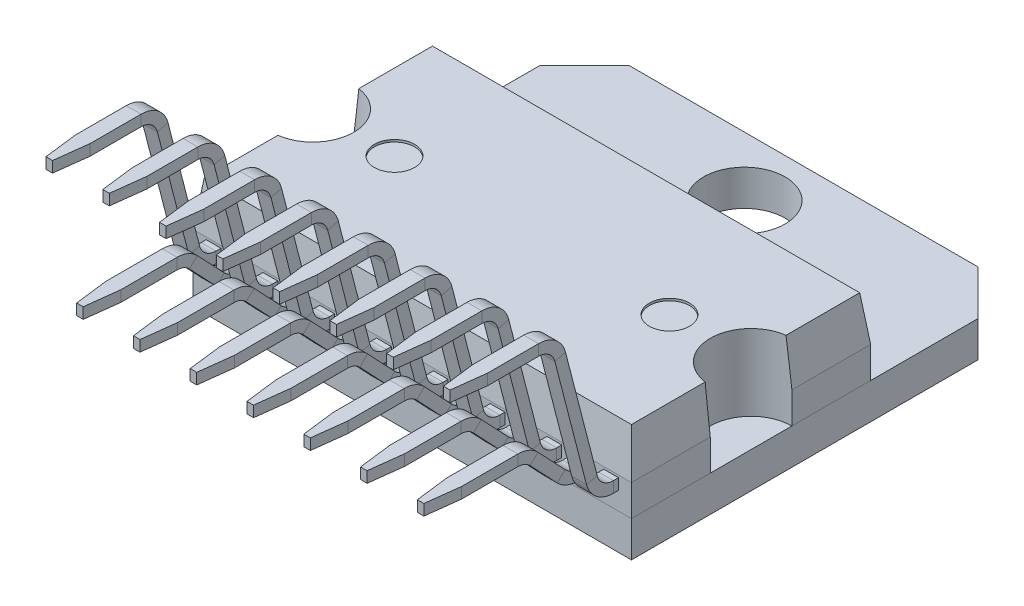
from build123d import *
from OCP.BRepFilletAPI import BRepFilletAPI_MakeChamfer

# Parameters (mm, degrees)
SKETCH_1_R                              = 1.825
EXTRUDE_1_DEPTH                         = 1.6
SKETCH_2_W                              = 19.6
SKETCH_2_H                              = 10.7
EXTRUDE_2_DEPTH                         = 3.4
CHAMFER_1_SIZE                          = 2
CHAMFER_1_SIZE2                         = 0.245569122
SKETCH_3_R                              = 1.825
CUT_EXTRUDE_1_DEPTH                     = 3.4
SKETCH_4_R                              = 0.9
CUT_EXTRUDE_2_DEPTH                     = 0.1
SKETCH_6_W                              = 0.66
SKETCH_6_H                              = 0.49
CHAMFER_2_SIZE                          = 1.5
CHAMFER_2_SIZE2                         = 0.184176841
PATTERN_LINEAR_4_COUNT                  = 4
PATTERN_LINEAR_4_PITCH                  = 2.54
CHAMFER_2_OF_PATTERN_LINEAR_4_SIZE      = 1.5
CHAMFER_2_OF_PATTERN_LINEAR_4_SIZE2     = 0.184176841
PATTERN_LINEAR_4_COL_COUNT              = 4
PATTERN_LINEAR_4_COL_PITCH              = 2.54
CHAMFER_2_OF_PATTERN_LINEAR_4_COL_SIZE  = 1.5
CHAMFER_2_OF_PATTERN_LINEAR_4_COL_SIZE2 = 0.184176841
SKETCH_8_W                              = 0.66
SKETCH_8_H                              = 0.49
CHAMFER_3_SIZE                          = 1.5
CHAMFER_3_SIZE2                         = 0.184176841
PATTERN_LINEAR_5_COUNT                  = 8
PATTERN_LINEAR_5_PITCH                  = 2.54
CHAMFER_3_OF_PATTERN_LINEAR_5_SIZE      = 1.5
CHAMFER_3_OF_PATTERN_LINEAR_5_SIZE2     = 0.184176841


with BuildPart() as part:
    # 草图1 → 凸台-拉伸1 (new body)
    with BuildSketch(Plane(origin=(0, 0, 0), x_dir=(1, 0, 0), z_dir=(0, 1, 0))):
        Polygon((0, 0), (-9.8, 0), (-9.8, 15.5), (-7.8, 17.5), (7.8, 17.5), (9.8, 15.5), (9.8, 0), align=None)
        with Locations(Location((0, 14.85, 0), (0, 0, 270))):
            Circle(SKETCH_1_R, mode=Mode.SUBTRACT)
    extrude(amount=EXTRUDE_1_DEPTH)


with BuildPart() as body_2:
    # 草图2 → 凸台-拉伸2 (new body)
    with BuildSketch(Plane(origin=(0, 1.6, 0), x_dir=(1, 0, 0), z_dir=(0, 1, 0))):
        with Locations((0, 5.35)):
            Rectangle(SKETCH_2_W, SKETCH_2_H)
    extrude(amount=EXTRUDE_2_DEPTH)

    # 倒角1: one chamfer whose edges measure the first distance from different faces: ONE call of the kernel's chamfer builder (chamfer() names one face for all edges)
    chamfer_1_edges_1 = [body_2.edges().sort_by_distance(p)[0] for p in [
        (9.8, 5, -5.35),
    ]]
    chamfer_1_side_1 = [body_2.faces().sort_by_distance(p)[0] for p in [
        (9.8, 3.3, -5.35),
    ]]
    chamfer_1_edges_2 = [body_2.edges().sort_by_distance(p)[0] for p in [
        (0, 5, -10.7),
    ]]
    chamfer_1_side_2 = [body_2.faces().sort_by_distance(p)[0] for p in [
        (0, 3.3, -10.7),
    ]]
    chamfer_1_edges_3 = [body_2.edges().sort_by_distance(p)[0] for p in [
        (-9.8, 5, -5.35),
    ]]
    chamfer_1_side_3 = [body_2.faces().sort_by_distance(p)[0] for p in [
        (-9.8, 3.3, -5.35),
    ]]
    chamfer_1_edges_4 = [body_2.edges().sort_by_distance(p)[0] for p in [
        (0, 5, 0),
    ]]
    chamfer_1_side_4 = [body_2.faces().sort_by_distance(p)[0] for p in [
        (0, 3.3, 0),
    ]]
    chamfer_1 = BRepFilletAPI_MakeChamfer(body_2.part.solid().wrapped)
    for e in chamfer_1_edges_1:
        chamfer_1.Add(CHAMFER_1_SIZE, CHAMFER_1_SIZE2, e.wrapped, chamfer_1_side_1[0].wrapped)  # the first distance lies on this face
    for e in chamfer_1_edges_2:
        chamfer_1.Add(CHAMFER_1_SIZE, CHAMFER_1_SIZE2, e.wrapped, chamfer_1_side_2[0].wrapped)  # the first distance lies on this face
    for e in chamfer_1_edges_3:
        chamfer_1.Add(CHAMFER_1_SIZE, CHAMFER_1_SIZE2, e.wrapped, chamfer_1_side_3[0].wrapped)  # the first distance lies on this face
    for e in chamfer_1_edges_4:
        chamfer_1.Add(CHAMFER_1_SIZE, CHAMFER_1_SIZE2, e.wrapped, chamfer_1_side_4[0].wrapped)  # the first distance lies on this face
    add(Compound.cast(chamfer_1.Shape()), mode=Mode.REPLACE)

    # 草图3 → 切除-拉伸1 (cut)
    with BuildSketch(Plane(origin=(0, 5, 0), x_dir=(1, 0, 0), z_dir=(0, 1, 0))):
        with Locations((-9.8, 5.35)):
            Circle(SKETCH_3_R)
        with Locations((9.8, 5.35)):
            Circle(SKETCH_3_R)
    extrude(amount=-CUT_EXTRUDE_1_DEPTH, mode=Mode.SUBTRACT)

    # 草图4 → 切除-拉伸2 (cut)
    with BuildSketch(Plane(origin=(0, 5, 0), x_dir=(1, 0, 0), z_dir=(0, 1, 0))):
        with Locations(Location((-6.15, 5.35, 0), (0, 0, 270))):
            Circle(SKETCH_4_R)
        with Locations(Location((6.15, 5.35, 0), (0, 0, 90))):
            Circle(SKETCH_4_R)
    extrude(amount=-CUT_EXTRUDE_2_DEPTH, mode=Mode.SUBTRACT)

    # 扫描2: sweep along a path in 草图5
    with BuildLine(Plane(origin=(0, 0, 0), x_dir=(0, 0, -1), z_dir=(1, 0, 0))) as sweep_2_path:
        Line((0, 2.65), (-0.569868176, 2.65))
        ThreePointArc((-0.569868176, 2.65), (-0.964998124, 2.731374764), (-1.29582086, 2.962255352))
        Line((-1.29582086, 2.962255352), (-2.50417914, 4.237744648))
        ThreePointArc((-2.50417914, 4.237744648), (-2.835001876, 4.468625236), (-3.230131824, 4.55))
        Line((-3.230131824, 4.55), (-7.25, 4.55))
    # 草图6 → 扫描2 (sweep)
    with BuildSketch(Plane.XY):
        with Locations((0, 2.65)):
            Rectangle(SKETCH_6_W, SKETCH_6_H)
    sweep_2 = sweep(path=sweep_2_path.line)

    # 倒角2: one chamfer whose edges measure the first distance from different faces: ONE call of the kernel's chamfer builder (chamfer() names one face for all edges)
    chamfer_2_edges_1 = [body_2.edges().sort_by_distance(p)[0] for p in [
        (0.33, 4.55, 7.25),
    ]]
    chamfer_2_side_1 = [body_2.faces().sort_by_distance(p)[0] for p in [
        (0.33, 2.481337802, 0.284934088),
    ]]
    chamfer_2_edges_2 = [body_2.edges().sort_by_distance(p)[0] for p in [
        (-0.33, 4.55, 7.25),
    ]]
    chamfer_2_side_2 = [body_2.faces().sort_by_distance(p)[0] for p in [
        (-0.33, 2.818662198, 0.284934088),
    ]]
    chamfer_2 = BRepFilletAPI_MakeChamfer(body_2.part.solid().wrapped)
    for e in chamfer_2_edges_1:
        chamfer_2.Add(CHAMFER_2_SIZE, CHAMFER_2_SIZE2, e.wrapped, chamfer_2_side_1[0].wrapped)  # the first distance lies on this face
    for e in chamfer_2_edges_2:
        chamfer_2.Add(CHAMFER_2_SIZE, CHAMFER_2_SIZE2, e.wrapped, chamfer_2_side_2[0].wrapped)  # the first distance lies on this face
    add(Compound.cast(chamfer_2.Shape()), mode=Mode.REPLACE)

    # 阵列(线性)4: 扫描2 ×4
    with Locations(*[(i * PATTERN_LINEAR_4_PITCH, 0, 0) for i in range(1, PATTERN_LINEAR_4_COUNT)]):
        add(sweep_2)

    # 倒角2 of 阵列(线性)4: one chamfer whose edges measure the first distance from different faces: ONE call of the kernel's chamfer builder (chamfer() names one face for all edges)
    chamfer_2_of_pattern_linear_4_edges_1 = [body_2.edges().sort_by_distance(p)[0] for p in [
        (2.87, 4.55, 7.25),
    ]]
    chamfer_2_of_pattern_linear_4_side_1 = [body_2.faces().sort_by_distance(p)[0] for p in [
        (2.87, 2.481337802, 0.284934088),
    ]]
    chamfer_2_of_pattern_linear_4_edges_2 = [body_2.edges().sort_by_distance(p)[0] for p in [
        (2.21, 4.55, 7.25),
    ]]
    chamfer_2_of_pattern_linear_4_side_2 = [body_2.faces().sort_by_distance(p)[0] for p in [
        (2.21, 2.818662198, 0.284934088),
    ]]
    chamfer_2_of_pattern_linear_4_edges_3 = [body_2.edges().sort_by_distance(p)[0] for p in [
        (5.41, 4.55, 7.25),
    ]]
    chamfer_2_of_pattern_linear_4_side_3 = [body_2.faces().sort_by_distance(p)[0] for p in [
        (5.41, 2.481337802, 0.284934088),
    ]]
    chamfer_2_of_pattern_linear_4_edges_4 = [body_2.edges().sort_by_distance(p)[0] for p in [
        (4.75, 4.55, 7.25),
    ]]
    chamfer_2_of_pattern_linear_4_side_4 = [body_2.faces().sort_by_distance(p)[0] for p in [
        (4.75, 2.818662198, 0.284934088),
    ]]
    chamfer_2_of_pattern_linear_4_edges_5 = [body_2.edges().sort_by_distance(p)[0] for p in [
        (7.95, 4.55, 7.25),
    ]]
    chamfer_2_of_pattern_linear_4_side_5 = [body_2.faces().sort_by_distance(p)[0] for p in [
        (7.95, 2.481337802, 0.284934088),
    ]]
    chamfer_2_of_pattern_linear_4_edges_6 = [body_2.edges().sort_by_distance(p)[0] for p in [
        (7.29, 4.55, 7.25),
    ]]
    chamfer_2_of_pattern_linear_4_side_6 = [body_2.faces().sort_by_distance(p)[0] for p in [
        (7.29, 2.818662198, 0.284934088),
    ]]
    chamfer_2_of_pattern_linear_4 = BRepFilletAPI_MakeChamfer(body_2.part.solid().wrapped)
    for e in chamfer_2_of_pattern_linear_4_edges_1:
        chamfer_2_of_pattern_linear_4.Add(CHAMFER_2_OF_PATTERN_LINEAR_4_SIZE, CHAMFER_2_OF_PATTERN_LINEAR_4_SIZE2, e.wrapped, chamfer_2_of_pattern_linear_4_side_1[0].wrapped)  # the first distance lies on this face
    for e in chamfer_2_of_pattern_linear_4_edges_2:
        chamfer_2_of_pattern_linear_4.Add(CHAMFER_2_OF_PATTERN_LINEAR_4_SIZE, CHAMFER_2_OF_PATTERN_LINEAR_4_SIZE2, e.wrapped, chamfer_2_of_pattern_linear_4_side_2[0].wrapped)  # the first distance lies on this face
    for e in chamfer_2_of_pattern_linear_4_edges_3:
        chamfer_2_of_pattern_linear_4.Add(CHAMFER_2_OF_PATTERN_LINEAR_4_SIZE, CHAMFER_2_OF_PATTERN_LINEAR_4_SIZE2, e.wrapped, chamfer_2_of_pattern_linear_4_side_3[0].wrapped)  # the first distance lies on this face
    for e in chamfer_2_of_pattern_linear_4_edges_4:
        chamfer_2_of_pattern_linear_4.Add(CHAMFER_2_OF_PATTERN_LINEAR_4_SIZE, CHAMFER_2_OF_PATTERN_LINEAR_4_SIZE2, e.wrapped, chamfer_2_of_pattern_linear_4_side_4[0].wrapped)  # the first distance lies on this face
    for e in chamfer_2_of_pattern_linear_4_edges_5:
        chamfer_2_of_pattern_linear_4.Add(CHAMFER_2_OF_PATTERN_LINEAR_4_SIZE, CHAMFER_2_OF_PATTERN_LINEAR_4_SIZE2, e.wrapped, chamfer_2_of_pattern_linear_4_side_5[0].wrapped)  # the first distance lies on this face
    for e in chamfer_2_of_pattern_linear_4_edges_6:
        chamfer_2_of_pattern_linear_4.Add(CHAMFER_2_OF_PATTERN_LINEAR_4_SIZE, CHAMFER_2_OF_PATTERN_LINEAR_4_SIZE2, e.wrapped, chamfer_2_of_pattern_linear_4_side_6[0].wrapped)  # the first distance lies on this face
    add(Compound.cast(chamfer_2_of_pattern_linear_4.Shape()), mode=Mode.REPLACE)

    # 阵列(线性)4 col: 扫描2 ×4
    with Locations(*[(-i * PATTERN_LINEAR_4_COL_PITCH, 0, 0) for i in range(1, PATTERN_LINEAR_4_COL_COUNT)]):
        add(sweep_2)

    # 倒角2 of 阵列(线性)4 col: one chamfer whose edges measure the first distance from different faces: ONE call of the kernel's chamfer builder (chamfer() names one face for all edges)
    chamfer_2_of_pattern_linear_4_col_edges_1 = [body_2.edges().sort_by_distance(p)[0] for p in [
        (-2.21, 4.55, 7.25),
    ]]
    chamfer_2_of_pattern_linear_4_col_side_1 = [body_2.faces().sort_by_distance(p)[0] for p in [
        (-2.21, 2.481337802, 0.284934088),
    ]]
    chamfer_2_of_pattern_linear_4_col_edges_2 = [body_2.edges().sort_by_distance(p)[0] for p in [
        (-2.87, 4.55, 7.25),
    ]]
    chamfer_2_of_pattern_linear_4_col_side_2 = [body_2.faces().sort_by_distance(p)[0] for p in [
        (-2.87, 2.818662198, 0.284934088),
    ]]
    chamfer_2_of_pattern_linear_4_col_edges_3 = [body_2.edges().sort_by_distance(p)[0] for p in [
        (-4.75, 4.55, 7.25),
    ]]
    chamfer_2_of_pattern_linear_4_col_side_3 = [body_2.faces().sort_by_distance(p)[0] for p in [
        (-4.75, 2.481337802, 0.284934088),
    ]]
    chamfer_2_of_pattern_linear_4_col_edges_4 = [body_2.edges().sort_by_distance(p)[0] for p in [
        (-5.41, 4.55, 7.25),
    ]]
    chamfer_2_of_pattern_linear_4_col_side_4 = [body_2.faces().sort_by_distance(p)[0] for p in [
        (-5.41, 2.818662198, 0.284934088),
    ]]
    chamfer_2_of_pattern_linear_4_col_edges_5 = [body_2.edges().sort_by_distance(p)[0] for p in [
        (-7.29, 4.55, 7.25),
    ]]
    chamfer_2_of_pattern_linear_4_col_side_5 = [body_2.faces().sort_by_distance(p)[0] for p in [
        (-7.29, 2.481337802, 0.284934088),
    ]]
    chamfer_2_of_pattern_linear_4_col_edges_6 = [body_2.edges().sort_by_distance(p)[0] for p in [
        (-7.95, 4.55, 7.25),
    ]]
    chamfer_2_of_pattern_linear_4_col_side_6 = [body_2.faces().sort_by_distance(p)[0] for p in [
        (-7.95, 2.818662198, 0.284934088),
    ]]
    chamfer_2_of_pattern_linear_4_col = BRepFilletAPI_MakeChamfer(body_2.part.solid().wrapped)
    for e in chamfer_2_of_pattern_linear_4_col_edges_1:
        chamfer_2_of_pattern_linear_4_col.Add(CHAMFER_2_OF_PATTERN_LINEAR_4_COL_SIZE, CHAMFER_2_OF_PATTERN_LINEAR_4_COL_SIZE2, e.wrapped, chamfer_2_of_pattern_linear_4_col_side_1[0].wrapped)  # the first distance lies on this face
    for e in chamfer_2_of_pattern_linear_4_col_edges_2:
        chamfer_2_of_pattern_linear_4_col.Add(CHAMFER_2_OF_PATTERN_LINEAR_4_COL_SIZE, CHAMFER_2_OF_PATTERN_LINEAR_4_COL_SIZE2, e.wrapped, chamfer_2_of_pattern_linear_4_col_side_2[0].wrapped)  # the first distance lies on this face
    for e in chamfer_2_of_pattern_linear_4_col_edges_3:
        chamfer_2_of_pattern_linear_4_col.Add(CHAMFER_2_OF_PATTERN_LINEAR_4_COL_SIZE, CHAMFER_2_OF_PATTERN_LINEAR_4_COL_SIZE2, e.wrapped, chamfer_2_of_pattern_linear_4_col_side_3[0].wrapped)  # the first distance lies on this face
    for e in chamfer_2_of_pattern_linear_4_col_edges_4:
        chamfer_2_of_pattern_linear_4_col.Add(CHAMFER_2_OF_PATTERN_LINEAR_4_COL_SIZE, CHAMFER_2_OF_PATTERN_LINEAR_4_COL_SIZE2, e.wrapped, chamfer_2_of_pattern_linear_4_col_side_4[0].wrapped)  # the first distance lies on this face
    for e in chamfer_2_of_pattern_linear_4_col_edges_5:
        chamfer_2_of_pattern_linear_4_col.Add(CHAMFER_2_OF_PATTERN_LINEAR_4_COL_SIZE, CHAMFER_2_OF_PATTERN_LINEAR_4_COL_SIZE2, e.wrapped, chamfer_2_of_pattern_linear_4_col_side_5[0].wrapped)  # the first distance lies on this face
    for e in chamfer_2_of_pattern_linear_4_col_edges_6:
        chamfer_2_of_pattern_linear_4_col.Add(CHAMFER_2_OF_PATTERN_LINEAR_4_COL_SIZE, CHAMFER_2_OF_PATTERN_LINEAR_4_COL_SIZE2, e.wrapped, chamfer_2_of_pattern_linear_4_col_side_6[0].wrapped)  # the first distance lies on this face
    add(Compound.cast(chamfer_2_of_pattern_linear_4_col.Shape()), mode=Mode.REPLACE)

    # 扫描3: sweep along a path in 草图7
    with BuildLine(Plane(origin=(0, 0, 0), x_dir=(0, 0, -1), z_dir=(1, 0, 0))) as sweep_3_path:
        Line((0, 2.65), (-0.225163859, 2.65))
        ThreePointArc((-0.225163859, 2.65), (-0.837654599, 2.859522237), (-1.193484479, 3.400289812))
        Line((-1.193484479, 3.400289812), (-2.606515521, 8.879710188))
        ThreePointArc((-2.606515521, 8.879710188), (-2.962345401, 9.420477763), (-3.574836141, 9.63))
        Line((-3.574836141, 9.63), (-7.35, 9.63))
    # 草图8 → 扫描3 (sweep)
    with BuildSketch(Plane.XY):
        with Locations((8.89, 2.65)):
            Rectangle(SKETCH_8_W, SKETCH_8_H)
    sweep_3 = sweep(path=sweep_3_path.line)

    # 倒角3: one chamfer whose edges measure the first distance from different faces: ONE call of the kernel's chamfer builder (chamfer() names one face for all edges)
    chamfer_3_edges_1 = [body_2.edges().sort_by_distance(p)[0] for p in [
        (9.22, 9.63, 7.35),
    ]]
    chamfer_3_side_1 = [body_2.faces().sort_by_distance(p)[0] for p in [
        (9.22, 2.50979666, 0.11258193),
    ]]
    chamfer_3_edges_2 = [body_2.edges().sort_by_distance(p)[0] for p in [
        (8.56, 9.63, 7.35),
    ]]
    chamfer_3_side_2 = [body_2.faces().sort_by_distance(p)[0] for p in [
        (8.56, 2.79020334, 0.11258193),
    ]]
    chamfer_3 = BRepFilletAPI_MakeChamfer(body_2.part.solid().wrapped)
    for e in chamfer_3_edges_1:
        chamfer_3.Add(CHAMFER_3_SIZE, CHAMFER_3_SIZE2, e.wrapped, chamfer_3_side_1[0].wrapped)  # the first distance lies on this face
    for e in chamfer_3_edges_2:
        chamfer_3.Add(CHAMFER_3_SIZE, CHAMFER_3_SIZE2, e.wrapped, chamfer_3_side_2[0].wrapped)  # the first distance lies on this face
    add(Compound.cast(chamfer_3.Shape()), mode=Mode.REPLACE)

    # 阵列(线性)5: 扫描3 ×8
    with Locations(*[(-i * PATTERN_LINEAR_5_PITCH, 0, 0) for i in range(1, PATTERN_LINEAR_5_COUNT)]):
        add(sweep_3)

    # 倒角3 of 阵列(线性)5: one chamfer whose edges measure the first distance from different faces: ONE call of the kernel's chamfer builder (chamfer() names one face for all edges)
    chamfer_3_of_pattern_linear_5_edges_1 = [body_2.edges().sort_by_distance(p)[0] for p in [
        (6.68, 9.63, 7.35),
    ]]
    chamfer_3_of_pattern_linear_5_side_1 = [body_2.faces().sort_by_distance(p)[0] for p in [
        (6.68, 2.50979666, 0.11258193),
    ]]
    chamfer_3_of_pattern_linear_5_edges_2 = [body_2.edges().sort_by_distance(p)[0] for p in [
        (6.02, 9.63, 7.35),
    ]]
    chamfer_3_of_pattern_linear_5_side_2 = [body_2.faces().sort_by_distance(p)[0] for p in [
        (6.02, 2.79020334, 0.11258193),
    ]]
    chamfer_3_of_pattern_linear_5_edges_3 = [body_2.edges().sort_by_distance(p)[0] for p in [
        (4.14, 9.63, 7.35),
    ]]
    chamfer_3_of_pattern_linear_5_side_3 = [body_2.faces().sort_by_distance(p)[0] for p in [
        (4.14, 2.50979666, 0.11258193),
    ]]
    chamfer_3_of_pattern_linear_5_edges_4 = [body_2.edges().sort_by_distance(p)[0] for p in [
        (3.48, 9.63, 7.35),
    ]]
    chamfer_3_of_pattern_linear_5_side_4 = [body_2.faces().sort_by_distance(p)[0] for p in [
        (3.48, 2.79020334, 0.11258193),
    ]]
    chamfer_3_of_pattern_linear_5_edges_5 = [body_2.edges().sort_by_distance(p)[0] for p in [
        (1.6, 9.63, 7.35),
    ]]
    chamfer_3_of_pattern_linear_5_side_5 = [body_2.faces().sort_by_distance(p)[0] for p in [
        (1.6, 2.50979666, 0.11258193),
    ]]
    chamfer_3_of_pattern_linear_5_edges_6 = [body_2.edges().sort_by_distance(p)[0] for p in [
        (0.94, 9.63, 7.35),
    ]]
    chamfer_3_of_pattern_linear_5_side_6 = [body_2.faces().sort_by_distance(p)[0] for p in [
        (0.94, 2.79020334, 0.11258193),
    ]]
    chamfer_3_of_pattern_linear_5_edges_7 = [body_2.edges().sort_by_distance(p)[0] for p in [
        (-0.94, 9.63, 7.35),
    ]]
    chamfer_3_of_pattern_linear_5_side_7 = [body_2.faces().sort_by_distance(p)[0] for p in [
        (-0.94, 2.50979666, 0.11258193),
    ]]
    chamfer_3_of_pattern_linear_5_edges_8 = [body_2.edges().sort_by_distance(p)[0] for p in [
        (-1.6, 9.63, 7.35),
    ]]
    chamfer_3_of_pattern_linear_5_side_8 = [body_2.faces().sort_by_distance(p)[0] for p in [
        (-1.6, 2.79020334, 0.11258193),
    ]]
    chamfer_3_of_pattern_linear_5_edges_9 = [body_2.edges().sort_by_distance(p)[0] for p in [
        (-3.48, 9.63, 7.35),
    ]]
    chamfer_3_of_pattern_linear_5_side_9 = [body_2.faces().sort_by_distance(p)[0] for p in [
        (-3.48, 2.50979666, 0.11258193),
    ]]
    chamfer_3_of_pattern_linear_5_edges_10 = [body_2.edges().sort_by_distance(p)[0] for p in [
        (-4.14, 9.63, 7.35),
    ]]
    chamfer_3_of_pattern_linear_5_side_10 = [body_2.faces().sort_by_distance(p)[0] for p in [
        (-4.14, 2.79020334, 0.11258193),
    ]]
    chamfer_3_of_pattern_linear_5_edges_11 = [body_2.edges().sort_by_distance(p)[0] for p in [
        (-6.02, 9.63, 7.35),
    ]]
    chamfer_3_of_pattern_linear_5_side_11 = [body_2.faces().sort_by_distance(p)[0] for p in [
        (-6.02, 2.50979666, 0.11258193),
    ]]
    chamfer_3_of_pattern_linear_5_edges_12 = [body_2.edges().sort_by_distance(p)[0] for p in [
        (-6.68, 9.63, 7.35),
    ]]
    chamfer_3_of_pattern_linear_5_side_12 = [body_2.faces().sort_by_distance(p)[0] for p in [
        (-6.68, 2.79020334, 0.11258193),
    ]]
    chamfer_3_of_pattern_linear_5_edges_13 = [body_2.edges().sort_by_distance(p)[0] for p in [
        (-8.56, 9.63, 7.35),
    ]]
    chamfer_3_of_pattern_linear_5_side_13 = [body_2.faces().sort_by_distance(p)[0] for p in [
        (-8.56, 2.50979666, 0.11258193),
    ]]
    chamfer_3_of_pattern_linear_5_edges_14 = [body_2.edges().sort_by_distance(p)[0] for p in [
        (-9.22, 9.63, 7.35),
    ]]
    chamfer_3_of_pattern_linear_5_side_14 = [body_2.faces().sort_by_distance(p)[0] for p in [
        (-9.22, 2.79020334, 0.11258193),
    ]]
    chamfer_3_of_pattern_linear_5 = BRepFilletAPI_MakeChamfer(body_2.part.solid().wrapped)
    for e in chamfer_3_of_pattern_linear_5_edges_1:
        chamfer_3_of_pattern_linear_5.Add(CHAMFER_3_OF_PATTERN_LINEAR_5_SIZE, CHAMFER_3_OF_PATTERN_LINEAR_5_SIZE2, e.wrapped, chamfer_3_of_pattern_linear_5_side_1[0].wrapped)  # the first distance lies on this face
    for e in chamfer_3_of_pattern_linear_5_edges_2:
        chamfer_3_of_pattern_linear_5.Add(CHAMFER_3_OF_PATTERN_LINEAR_5_SIZE, CHAMFER_3_OF_PATTERN_LINEAR_5_SIZE2, e.wrapped, chamfer_3_of_pattern_linear_5_side_2[0].wrapped)  # the first distance lies on this face
    for e in chamfer_3_of_pattern_linear_5_edges_3:
        chamfer_3_of_pattern_linear_5.Add(CHAMFER_3_OF_PATTERN_LINEAR_5_SIZE, CHAMFER_3_OF_PATTERN_LINEAR_5_SIZE2, e.wrapped, chamfer_3_of_pattern_linear_5_side_3[0].wrapped)  # the first distance lies on this face
    for e in chamfer_3_of_pattern_linear_5_edges_4:
        chamfer_3_of_pattern_linear_5.Add(CHAMFER_3_OF_PATTERN_LINEAR_5_SIZE, CHAMFER_3_OF_PATTERN_LINEAR_5_SIZE2, e.wrapped, chamfer_3_of_pattern_linear_5_side_4[0].wrapped)  # the first distance lies on this face
    for e in chamfer_3_of_pattern_linear_5_edges_5:
        chamfer_3_of_pattern_linear_5.Add(CHAMFER_3_OF_PATTERN_LINEAR_5_SIZE, CHAMFER_3_OF_PATTERN_LINEAR_5_SIZE2, e.wrapped, chamfer_3_of_pattern_linear_5_side_5[0].wrapped)  # the first distance lies on this face
    for e in chamfer_3_of_pattern_linear_5_edges_6:
        chamfer_3_of_pattern_linear_5.Add(CHAMFER_3_OF_PATTERN_LINEAR_5_SIZE, CHAMFER_3_OF_PATTERN_LINEAR_5_SIZE2, e.wrapped, chamfer_3_of_pattern_linear_5_side_6[0].wrapped)  # the first distance lies on this face
    for e in chamfer_3_of_pattern_linear_5_edges_7:
        chamfer_3_of_pattern_linear_5.Add(CHAMFER_3_OF_PATTERN_LINEAR_5_SIZE, CHAMFER_3_OF_PATTERN_LINEAR_5_SIZE2, e.wrapped, chamfer_3_of_pattern_linear_5_side_7[0].wrapped)  # the first distance lies on this face
    for e in chamfer_3_of_pattern_linear_5_edges_8:
        chamfer_3_of_pattern_linear_5.Add(CHAMFER_3_OF_PATTERN_LINEAR_5_SIZE, CHAMFER_3_OF_PATTERN_LINEAR_5_SIZE2, e.wrapped, chamfer_3_of_pattern_linear_5_side_8[0].wrapped)  # the first distance lies on this face
    for e in chamfer_3_of_pattern_linear_5_edges_9:
        chamfer_3_of_pattern_linear_5.Add(CHAMFER_3_OF_PATTERN_LINEAR_5_SIZE, CHAMFER_3_OF_PATTERN_LINEAR_5_SIZE2, e.wrapped, chamfer_3_of_pattern_linear_5_side_9[0].wrapped)  # the first distance lies on this face
    for e in chamfer_3_of_pattern_linear_5_edges_10:
        chamfer_3_of_pattern_linear_5.Add(CHAMFER_3_OF_PATTERN_LINEAR_5_SIZE, CHAMFER_3_OF_PATTERN_LINEAR_5_SIZE2, e.wrapped, chamfer_3_of_pattern_linear_5_side_10[0].wrapped)  # the first distance lies on this face
    for e in chamfer_3_of_pattern_linear_5_edges_11:
        chamfer_3_of_pattern_linear_5.Add(CHAMFER_3_OF_PATTERN_LINEAR_5_SIZE, CHAMFER_3_OF_PATTERN_LINEAR_5_SIZE2, e.wrapped, chamfer_3_of_pattern_linear_5_side_11[0].wrapped)  # the first distance lies on this face
    for e in chamfer_3_of_pattern_linear_5_edges_12:
        chamfer_3_of_pattern_linear_5.Add(CHAMFER_3_OF_PATTERN_LINEAR_5_SIZE, CHAMFER_3_OF_PATTERN_LINEAR_5_SIZE2, e.wrapped, chamfer_3_of_pattern_linear_5_side_12[0].wrapped)  # the first distance lies on this face
    for e in chamfer_3_of_pattern_linear_5_edges_13:
        chamfer_3_of_pattern_linear_5.Add(CHAMFER_3_OF_PATTERN_LINEAR_5_SIZE, CHAMFER_3_OF_PATTERN_LINEAR_5_SIZE2, e.wrapped, chamfer_3_of_pattern_linear_5_side_13[0].wrapped)  # the first distance lies on this face
    for e in chamfer_3_of_pattern_linear_5_edges_14:
        chamfer_3_of_pattern_linear_5.Add(CHAMFER_3_OF_PATTERN_LINEAR_5_SIZE, CHAMFER_3_OF_PATTERN_LINEAR_5_SIZE2, e.wrapped, chamfer_3_of_pattern_linear_5_side_14[0].wrapped)  # the first distance lies on this face
    add(Compound.cast(chamfer_3_of_pattern_linear_5.Shape()), mode=Mode.REPLACE)


solid = Compound([part.part, body_2.part])
